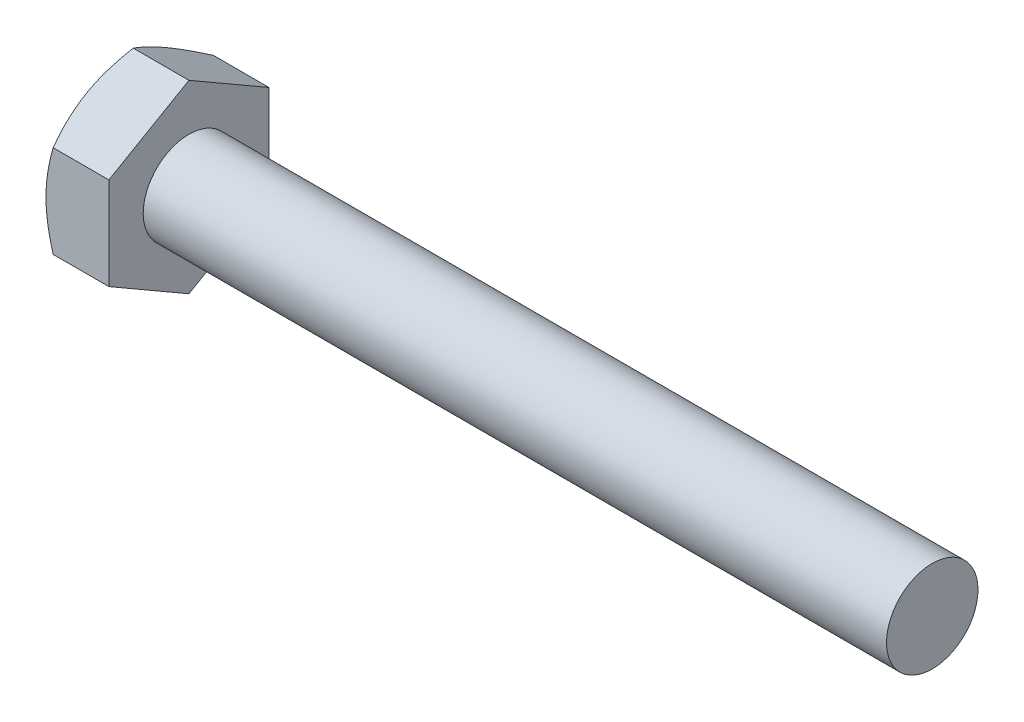
from build123d import *

# Parameters (mm, degrees)
SKETCH5_R           = 3.175
BOSS_EXTRUDE3_DEPTH = 51.59375
BOSS_EXTRUDE4_DEPTH = 4.365625
SKETCH8_OUTSIDE_W   = 224.338
SKETCH8_OUTSIDE_H   = 226.058
SKETCH8_OUTSIDE_R   = 5.55625
CUT_EXTRUDE3_DEPTH  = 57.599347315
CUT_EXTRUDE3_DRAFT  = -60


with BuildPart() as part:
    # Sketch5 → Boss-Extrude3 (new body)
    with BuildSketch(Plane(origin=(27.9796875, 0, 0), x_dir=(0, 0, -1), z_dir=(1, 0, 0))):
        Circle(SKETCH5_R)
    extrude(amount=-BOSS_EXTRUDE3_DEPTH)

    # Sketch6 → Boss-Extrude4 (add)
    with BuildSketch(Plane.ZY.offset(23.6140625)):
        Polygon((5.55625, 3.207902433), (0, 6.415804866), (-5.55625, 3.207902433), (-5.55625, -3.207902433), (0, -6.415804866), (5.55625, -3.207902433), align=None)
    extrude(amount=BOSS_EXTRUDE4_DEPTH)


with BuildPart() as cut_extrude3_tool:
    # Sketch8 outside → Cut-Extrude3 (with draft: the straight prism first)
    with BuildSketch(Plane.ZY.offset(27.9796875)):
        Rectangle(SKETCH8_OUTSIDE_W, SKETCH8_OUTSIDE_H)
        Circle(SKETCH8_OUTSIDE_R, mode=Mode.SUBTRACT)
    extrude(amount=-CUT_EXTRUDE3_DEPTH)
    # Cut-Extrude3: the draft: its side faces are tilted about the plane it starts from
    cut_extrude3_sides = [cut_extrude3_tool.faces().sort_by_distance(p)[0] for p in [
        (0.819986158, -113.029, 0),
        (0.819986158, 0, 112.169),
        (0.819986158, 113.029, 0),
        (0.819986158, 0, -112.169),
        (0.819986158, 0, -5.55625),
    ]]
    draft(cut_extrude3_sides, Plane.ZY.offset(27.9796875), CUT_EXTRUDE3_DRAFT)


with BuildPart() as part_1:
    add(part.part)

    # Cut-Extrude3: cut by cut_extrude3_tool
    add(cut_extrude3_tool.part, mode=Mode.SUBTRACT)


solid = part_1.part
